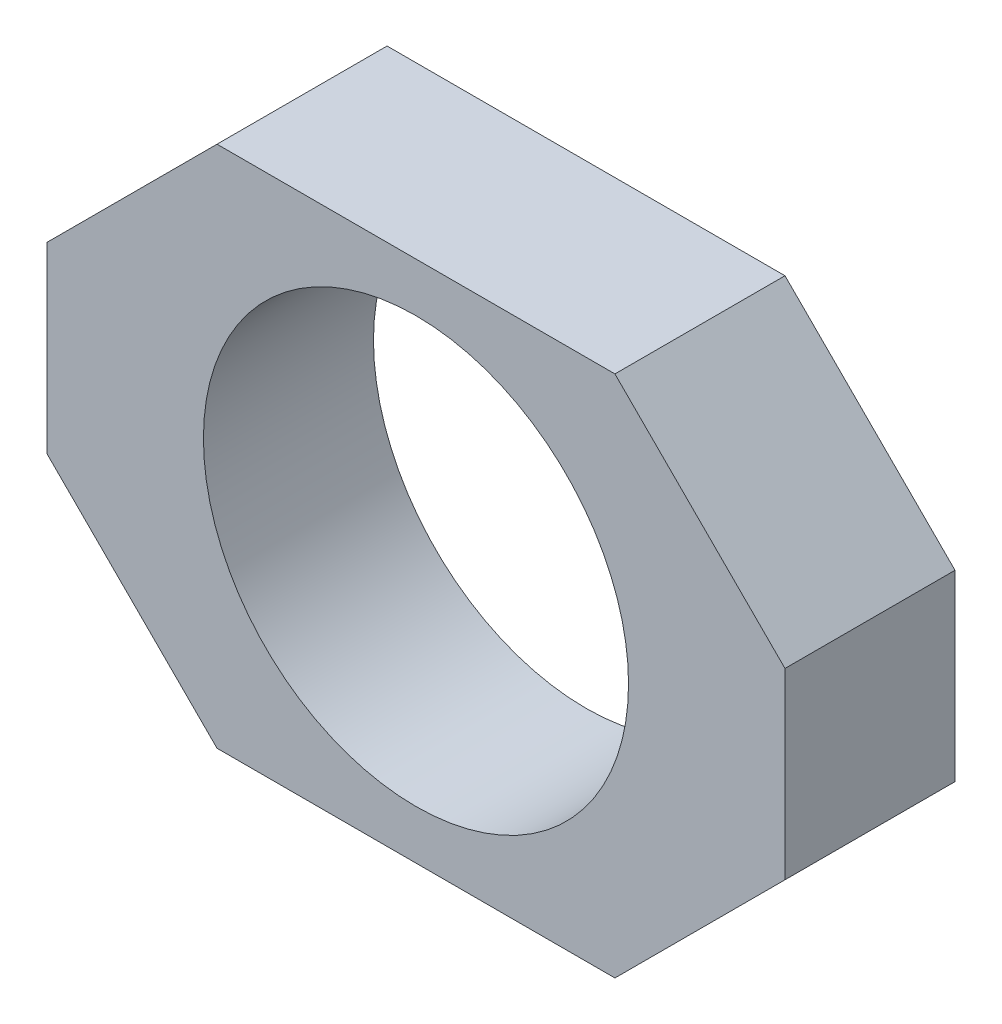
from build123d import *

# Parameters (mm, degrees)
SKETCH1_W           = 110.237040332
SKETCH1_H           = 78.14500721
BOSS_EXTRUDE1_DEPTH = 25.4
SKETCH2_R           = 31.75
CUT_EXTRUDE1_DEPTH  = 73.179441694
CHAMFER1_SIZE       = 25.4


with BuildPart() as part:
    # Sketch1 → Boss-Extrude1 (new body)
    with BuildSketch(Plane.XY):
        Rectangle(SKETCH1_W, SKETCH1_H)
    extrude(amount=-BOSS_EXTRUDE1_DEPTH)

    # Sketch2 → Cut-Extrude1 (cut, through all)
    with BuildSketch(Plane.XY):
        Circle(SKETCH2_R)
    extrude(amount=-CUT_EXTRUDE1_DEPTH, mode=Mode.SUBTRACT)

    # Chamfer1
    chamfer1_edges = [part.edges().sort_by_distance(p)[0] for p in [
        (55.118520166, -39.072503605, -12.7),
        (-55.118520166, -39.072503605, -12.7),
        (-55.118520166, 39.072503605, -12.7),
        (55.118520166, 39.072503605, -12.7),
    ]]
    chamfer(chamfer1_edges, length=CHAMFER1_SIZE)


solid = part.part
